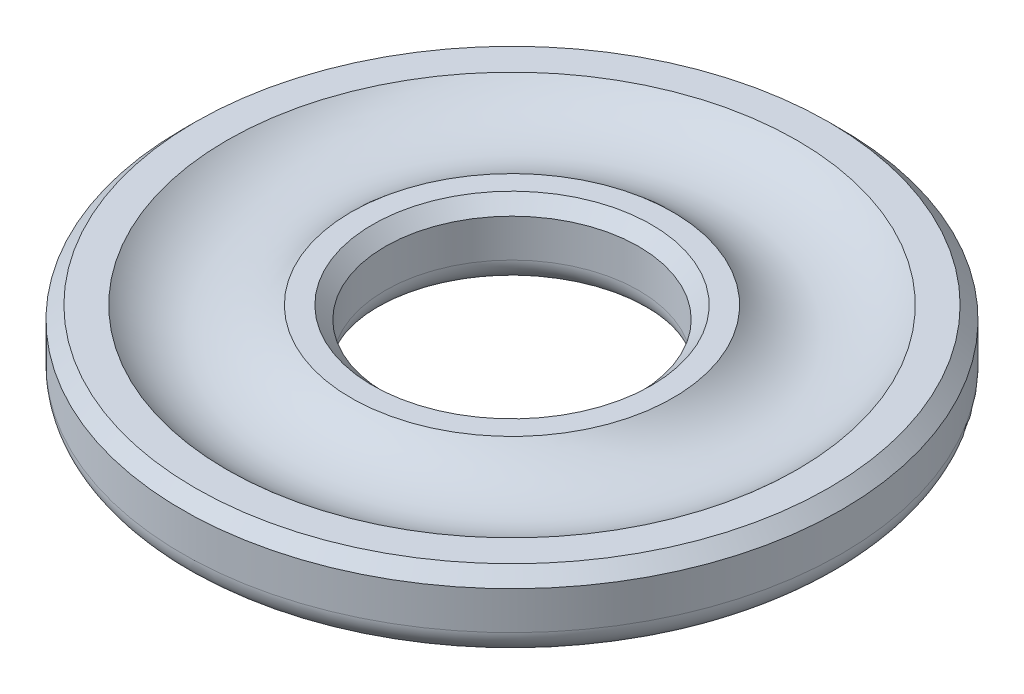
from build123d import *

# Parameters (mm, degrees)
CHAMFER1_SIZE = 0.5
FILLET2_R     = 1


with BuildPart() as part:
    # Sketch1 → Revolve1 (revolve)
    with BuildSketch(Plane.XY, mode=Mode.PRIVATE) as revolve1_sk:
        with BuildLine():
            Line((5, -2.5), (6.350510257, -2.5))
            ThreePointArc((6.350510257, -2.5), (8.8, -3.5), (11.249489743, -2.5))
            Line((11.249489743, -2.5), (13, -2.5))
            Line((13, -2.5), (13, -5.5))
            Line((13, -5.5), (5, -5.5))
            Line((5, -5.5), (5, -2.5))
        make_face()
    revolve(revolve1_sk.sketch.rotate(Axis((0, 5.5, 0), (0, -1, 0)), 180), axis=Axis((0, 5.5, 0), (0, -1, 0)))

    # Chamfer1
    chamfer1_edges = [part.edges().sort_by_distance(p)[0] for p in [
        (5, -2.5, 0),
        (13, -2.5, 0),
    ]]
    chamfer(chamfer1_edges, length=CHAMFER1_SIZE)

    # Fillet2
    fillet2_edges = [part.edges().sort_by_distance(p)[0] for p in [
        (13, -5.5, 0),
        (5, -5.5, 0),
    ]]
    fillet(fillet2_edges, radius=FILLET2_R)


solid = part.part
